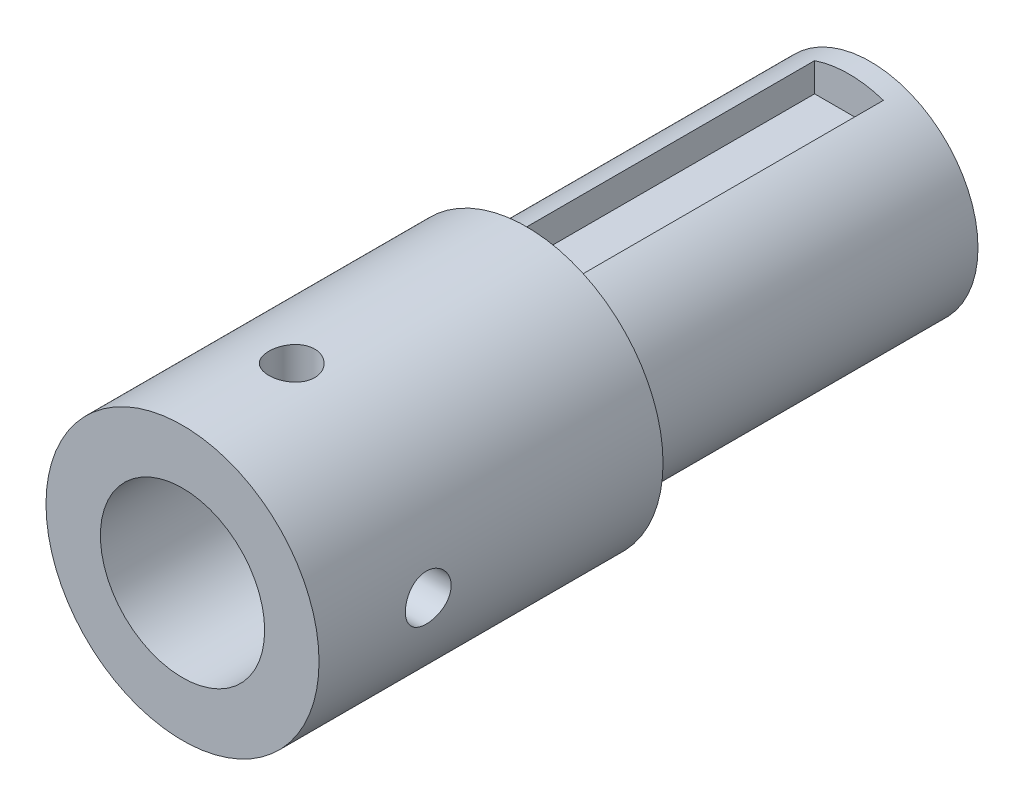
from build123d import *

# Parameters (mm, degrees)
SKETCH1_R               = 12.5
BOSS_EXTRUDE1_DEPTH     = 40
SKETCH2_W               = 8
SKETCH2_H               = 35
CUT_EXTRUDE1_DEPTH      = 4
SKETCH3_R               = 15.875
BOSS_EXTRUDE2_DEPTH     = 40
SKETCH5_R               = 9.5504
CUT_EXTRUDE2_DEPTH      = 25.4
CUT_EXTRUDE3_REACH      = 85.091
CUT_EXTRUDE3_END_RADIUS = 15.875
SKETCH6_R               = 2.665
CIRPATTERN1_COUNT       = 2
CIRPATTERN1_ANGLE       = 90


with BuildPart() as part:
    # Sketch1 → Boss-Extrude1 (new body)
    with BuildSketch(Plane.XY):
        Circle(SKETCH1_R)
    extrude(amount=BOSS_EXTRUDE1_DEPTH)

    # Sketch2 → Cut-Extrude1 (cut)
    with BuildSketch(Plane(origin=(0, 12.5, 0), x_dir=(1, 0, 0), z_dir=(0, 1, 0))):
        with Locations((0, -20)):
            Rectangle(SKETCH2_W, SKETCH2_H)
    extrude(amount=-CUT_EXTRUDE1_DEPTH, mode=Mode.SUBTRACT)

    # Sketch3 → Boss-Extrude2 (add)
    with BuildSketch(Plane.XY.offset(40)):
        Circle(SKETCH3_R)
    extrude(amount=BOSS_EXTRUDE2_DEPTH)

    # Sketch5 → Cut-Extrude2 (cut)
    with BuildSketch(Plane.XY.offset(80)):
        Circle(SKETCH5_R)
    extrude(amount=-CUT_EXTRUDE2_DEPTH, mode=Mode.SUBTRACT)

    # Cut-Extrude3: up to this cylinder (the profile starts inside it)
    cut_extrude3_end = Plane(origin=(0, 0, 67.3), z_dir=(0, 0, -1)) * Cylinder(CUT_EXTRUDE3_END_RADIUS, 202.932, mode=Mode.PRIVATE)
    # Sketch6 → Cut-Extrude3 (cut, up to the surface)
    with BuildSketch(Plane(origin=(0, 0, 0), x_dir=(1, 0, 0), z_dir=(0, 1, 0)), mode=Mode.PRIVATE) as cut_extrude3_sk1:
        with Locations(Location((0, -67.3, 0), (0, 0, 90))):
            Circle(SKETCH6_R)
    cut_extrude3_tool1 = extrude(cut_extrude3_sk1.sketch, amount=CUT_EXTRUDE3_REACH, mode=Mode.PRIVATE) & cut_extrude3_end
    cut_extrude3 = cut_extrude3_tool1.solids().sort_by_distance((0, 0, 67.3))[0]
    add(cut_extrude3, mode=Mode.SUBTRACT)

    # CirPattern1: Cut-Extrude3 ×2 about axis
    cirpattern1_axis = Axis((0, 0, 80), (0, 0, -1))
    for i in range(1, CIRPATTERN1_COUNT):
        add(cut_extrude3.rotate(cirpattern1_axis, i * CIRPATTERN1_ANGLE / (CIRPATTERN1_COUNT - 1)), mode=Mode.SUBTRACT)


solid = part.part
